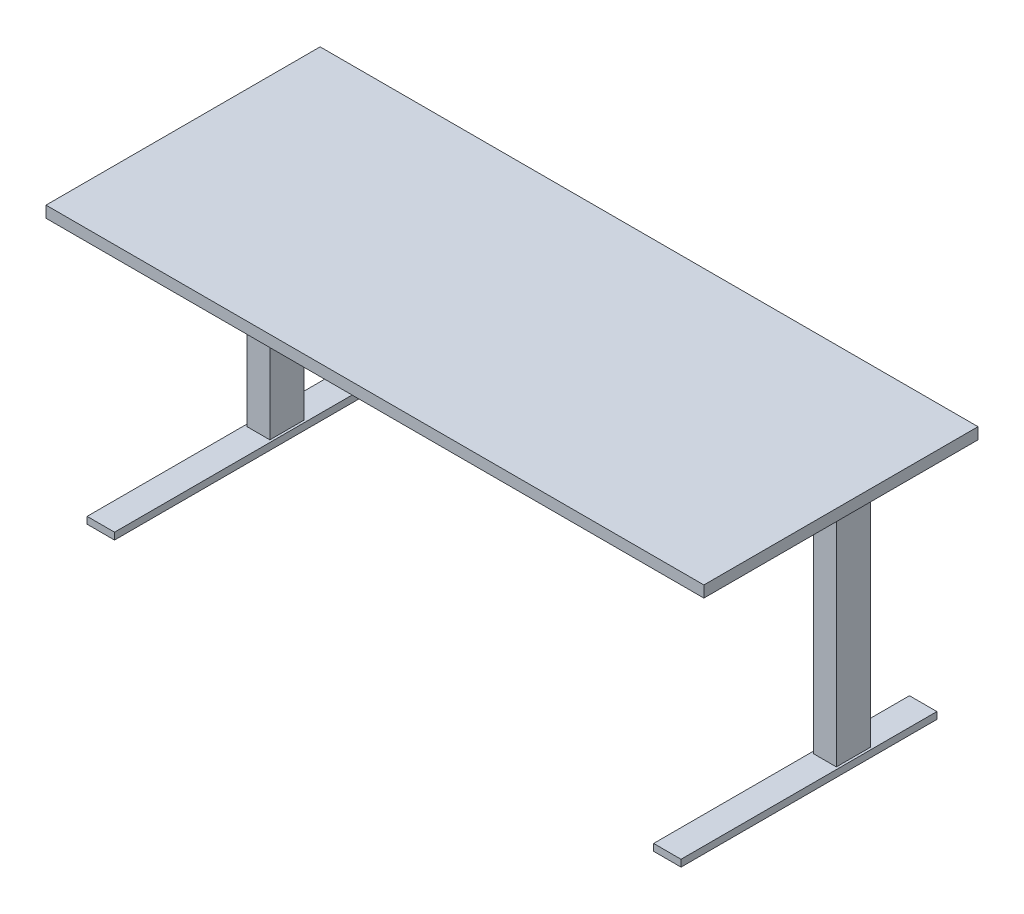
from build123d import *

# Parameters (mm, degrees)
SKETCH1_W           = 1828.8
SKETCH1_H           = 762
BOSS_EXTRUDE1_DEPTH = 31.75
SKETCH2_W           = 31.75
SKETCH2_H           = 241.3
BOSS_EXTRUDE2_DEPTH = 50.8
SKETCH3_W           = 63.5
SKETCH3_H           = 95.25
BOSS_EXTRUDE3_DEPTH = 685.8
SKETCH4_W           = 76.2
SKETCH4_H           = 711.2
BOSS_EXTRUDE4_DEPTH = 19.05


with BuildPart() as part:
    # Sketch1 → Boss-Extrude1 (new body)
    with BuildSketch(Plane(origin=(0, 0, 0), x_dir=(1, 0, 0), z_dir=(0, 1, 0))):
        Rectangle(SKETCH1_W, SKETCH1_H)
    extrude(amount=-BOSS_EXTRUDE1_DEPTH)

    # Sketch2 → Boss-Extrude2 (add)
    with BuildSketch(Plane.XZ.offset(31.75)):
        with Locations((-835.025, -158.75)):
            Rectangle(SKETCH2_W, SKETCH2_H)
    boss_extrude2 = extrude(amount=BOSS_EXTRUDE2_DEPTH)

    # Sketch3 → Boss-Extrude3 (add)
    with BuildSketch(Plane.XZ.offset(31.75)):
        with Locations((-787.4, -130.175)):
            Rectangle(SKETCH3_W, SKETCH3_H)
    boss_extrude3 = extrude(amount=BOSS_EXTRUDE3_DEPTH)

    # Sketch4 → Boss-Extrude4 (add)
    with BuildSketch(Plane.XZ.offset(717.55)):
        with Locations((-787.4, 0)):
            Rectangle(SKETCH4_W, SKETCH4_H)
    boss_extrude4 = extrude(amount=BOSS_EXTRUDE4_DEPTH)

    # Mirror1: Boss-Extrude2, Boss-Extrude3, Boss-Extrude4 across plane
    add(boss_extrude2.mirror(Plane(origin=(0, 0, 0), x_dir=(0, 0, 1), z_dir=(1, 0, 0))))
    add(boss_extrude3.mirror(Plane(origin=(0, 0, 0), x_dir=(0, 0, 1), z_dir=(1, 0, 0))))
    add(boss_extrude4.mirror(Plane(origin=(0, 0, 0), x_dir=(0, 0, 1), z_dir=(1, 0, 0))))


solid = part.part
